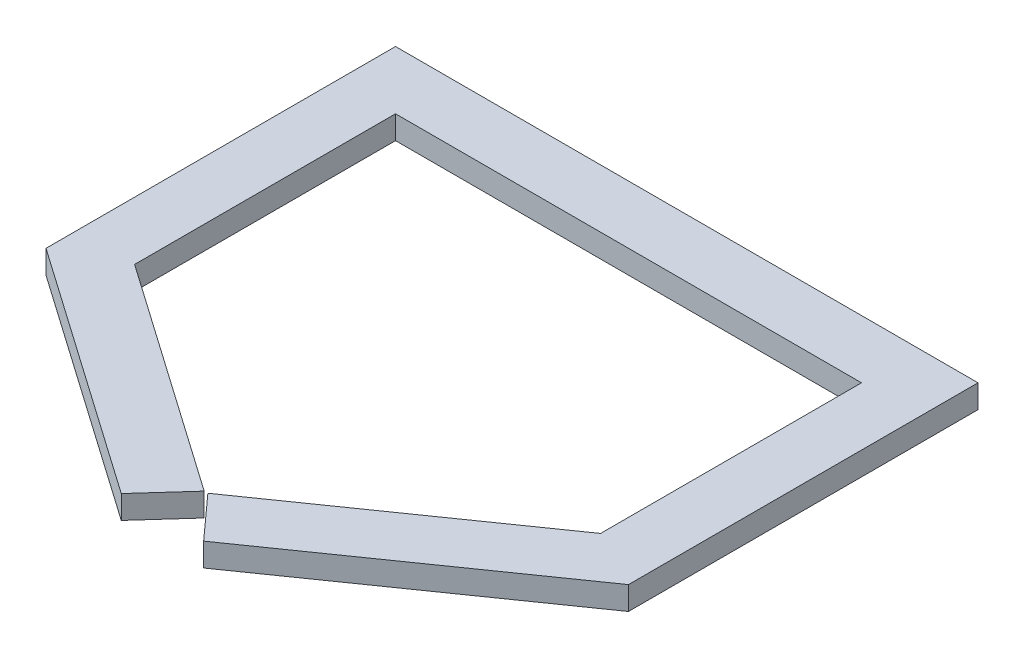
from build123d import *

# Parameters (mm, degrees)
BOSS_EXTRUDE1_DEPTH = 2


with BuildPart() as part:
    # Sketch2 → Boss-Extrude1 (new body)
    with BuildSketch(Plane(origin=(0, 0, 0), x_dir=(1, 0, 0), z_dir=(0, 1, 0))):
        Polygon((-24.9955, 22.5), (25, 22.5), (25, -7.5), (3.5355, -22.5), (0.157994699, -18.76037622), (1.961551057, -17.5), (20, -4.894221429), (20, 17.5), (-19.9955, 17.5), (-19.9955, -4.894534394), (-1.961280539, -17.5), (-0.158102294, -18.76037622), (-3.5355, -22.5), (-24.9955, -7.5), align=None)
    extrude(amount=BOSS_EXTRUDE1_DEPTH)


solid = part.part
